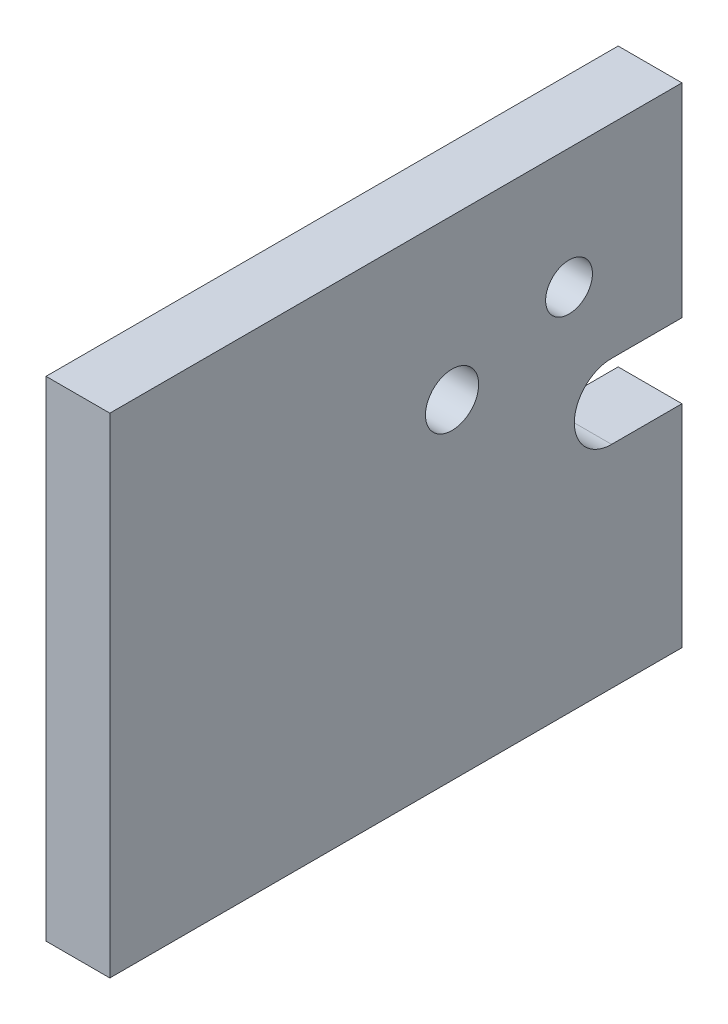
from build123d import *

# Parameters (mm, degrees)
SKETCH_1_W      = 5
SKETCH_1_H      = 5
SKETCH_1_R      = 1.1
EXTRUDE_1_DEPTH = 3
SKETCH_2_W      = 2.809830056
SKETCH_2_H      = 3.158804736
SKETCH_2_H_2    = 9.934341015
EXTRUDE_2_DEPTH = 3


with BuildPart() as part:
    # 草图1 → 凸台-拉伸1 (new body)
    with BuildSketch(Plane(origin=(0, 0, 0), x_dir=(0, 0, -1), z_dir=(1, 0, 0))):
        with Locations((2.5, -2.5)):
            Rectangle(SKETCH_1_W, SKETCH_1_H)
        with Locations((2.5, -2.5)):
            Circle(SKETCH_1_R, mode=Mode.SUBTRACT)
    extrude(amount=EXTRUDE_1_DEPTH)

    # 草图2 → 凸台-拉伸2 (add)
    with BuildSketch(Plane.ZY):
        with Locations((-6.404915028, 1.579402368)):
            Rectangle(SKETCH_2_W, SKETCH_2_H)
        Polygon((-5, 3.158804736), (-5, 0), (0, 0), (19.090169944, 0), (19.090169944, 3.158804736), align=None)
        Polygon((-5, -5), (-5, 0), (-7.809830056, 0), (-7.809830056, -6.406854249), (-5, -6.406854249), align=None)
        with BuildLine():
            Line((0, -5), (-5, -5))
            Line((-5, -5), (-5, -6.406854249))
            Line((-5, -6.406854249), (-4.5, -6.406854249))
            ThreePointArc((-4.5, -6.406854249), (-3.262563133, -6.919417382), (-2.75, -8.156854249))
            ThreePointArc((-2.75, -8.156854249), (-3.262563133, -9.394291117), (-4.5, -9.906854249))
            Line((-4.5, -9.906854249), (-5, -9.906854249))
            Line((-5, -9.906854249), (-5, -19.841195264))
            Line((-5, -19.841195264), (19.090169944, -19.841195264))
            Line((19.090169944, -19.841195264), (19.090169944, -5))
            Line((19.090169944, -5), (4.062297661, -5))
            ThreePointArc((4.062297661, -5), (3, -5.591195264), (1.937702339, -5))
            Line((1.937702339, -5), (0, -5))
        make_face()
        with BuildLine():
            Line((19.090169944, 0), (0, 0))
            Line((0, 0), (0, -5))
            Line((0, -5), (1.937702339, -5))
            ThreePointArc((1.937702339, -5), (2.657488742, -3.139036357), (4.25, -4.341195264))
            ThreePointArc((4.25, -4.341195264), (4.202158907, -4.683706522), (4.062297661, -5))
            Line((4.062297661, -5), (19.090169944, -5))
            Line((19.090169944, -5), (19.090169944, 0))
        make_face()
        with Locations((-6.404915028, -14.874024756)):
            Rectangle(SKETCH_2_W, SKETCH_2_H_2)
    extrude(amount=-EXTRUDE_2_DEPTH)


solid = part.part
